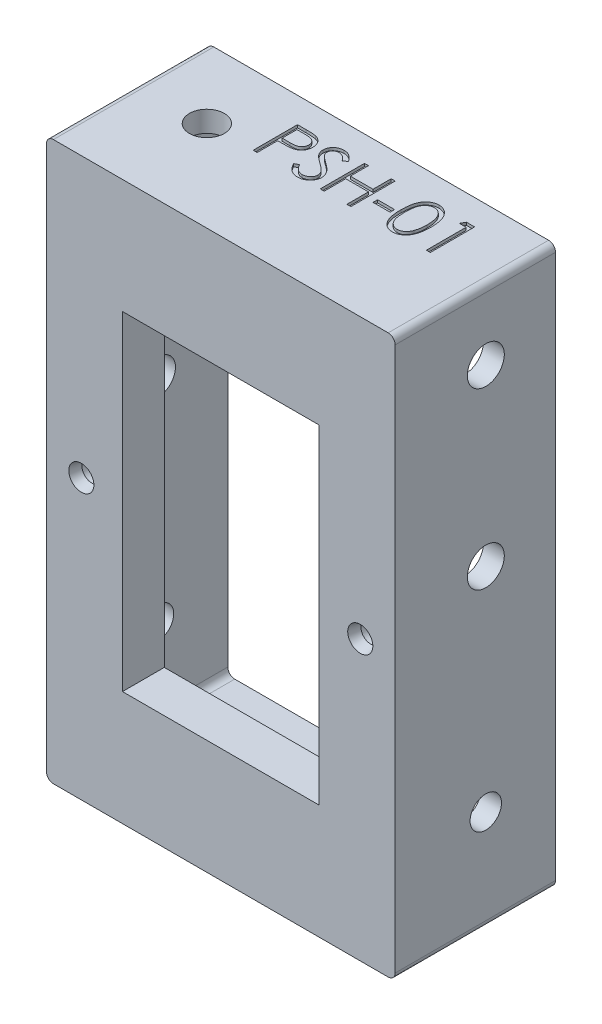
from build123d import *

# Parameters (mm, degrees)
SKETCH3_W                = 50
SKETCH3_H                = 80
SKETCH3_R                = 1.4
SKETCH3_W_2              = 28.2
SKETCH3_H_2              = 47.2
BOSS_EXTRUDE1_DEPTH      = 23
SKETCH4_W                = 44
SKETCH4_H                = 74
CUT_EXTRUDE1_DEPTH       = 17
CHAMFER1_SIZE            = 0.4
CHAMFER1_SIZE2           = 1.492820323
FILLET1_R                = 1
FILLET2_R                = 1
CUT_EXTRUDE2_REACH       = 99.103
SKETCH5_R                = 2.5
SKETCH5_R_2              = 2.25
M5_CLEARANCE_HOLE1_D     = 5.3
M5_CLEARANCE_HOLE1_DEPTH = 3
CUT_EXTRUDE3_REACH       = 99.103
SKETCH8_R                = 2.5
M5_CLEARANCE_HOLE2_D     = 5.3
M5_CLEARANCE_HOLE2_DEPTH = 3
SKETCH12_R               = 2.25
CUT_EXTRUDE4_DEPTH       = 96.592886765
SKETCH13_W               = 2.442307692
SKETCH13_H               = 0.651282051
CUT_EXTRUDE5_DEPTH       = 0.4


with BuildPart() as part:
    # Sketch3 → Boss-Extrude1 (new body)
    with BuildSketch(Plane.XY):
        with Locations((25, 40)):
            Rectangle(SKETCH3_W, SKETCH3_H)
        with Locations((5, 40)):
            Circle(SKETCH3_R, mode=Mode.SUBTRACT)
        with Locations((45, 40)):
            Circle(SKETCH3_R, mode=Mode.SUBTRACT)
        with Locations((25, 40)):
            Rectangle(SKETCH3_W_2, SKETCH3_H_2, mode=Mode.SUBTRACT)
    extrude(amount=BOSS_EXTRUDE1_DEPTH)

    # Sketch4 → Cut-Extrude1 (cut)
    with BuildSketch(Plane(origin=(0, 0, 0), x_dir=(-1, 0, 0), z_dir=(0, 0, -1))):
        with Locations((-25, 40)):
            Rectangle(SKETCH4_W, SKETCH4_H)
    extrude(amount=-CUT_EXTRUDE1_DEPTH, mode=Mode.SUBTRACT)

    # Chamfer1
    chamfer1_edges = [part.edges().sort_by_distance(p)[0] for p in [
        (3.6, 40, 23),
        (43.6, 40, 23),
    ]]
    chamfer1_side = [part.faces().sort_by_distance(p)[0] for p in [
        (25, 0.943398113, 23),
    ]]
    chamfer(chamfer1_edges, length=CHAMFER1_SIZE, length2=CHAMFER1_SIZE2, reference=chamfer1_side[0])

    # Fillet1
    fillet1_edges = [part.edges().sort_by_distance(p)[0] for p in [
        (0, 80, 11.5),
        (50, 80, 11.5),
        (50, 0, 11.5),
        (0, 0, 11.5),
    ]]
    fillet(fillet1_edges, radius=FILLET1_R)

    # Fillet2
    fillet2_edges = [part.edges().sort_by_distance(p)[0] for p in [
        (47, 3, 8.5),
        (47, 77, 8.5),
        (3, 77, 8.5),
        (3, 3, 8.5),
    ]]
    fillet(fillet2_edges, radius=FILLET2_R)

    # Sketch5 → Cut-Extrude2 (cut, up to next)
    with BuildSketch(Plane.ZY, mode=Mode.PRIVATE) as cut_extrude2_sk1:
        with Locations((10, 70)):
            Circle(SKETCH5_R)
    cut_extrude2_tool1 = extrude(cut_extrude2_sk1.sketch, amount=-CUT_EXTRUDE2_REACH, mode=Mode.PRIVATE) & part.part
    # Sketch5 → Cut-Extrude2 (cut, up to next)
    with BuildSketch(Plane.ZY, mode=Mode.PRIVATE) as cut_extrude2_sk2:
        with Locations((10, 45)):
            Circle(SKETCH5_R)
    cut_extrude2_tool2 = extrude(cut_extrude2_sk2.sketch, amount=-CUT_EXTRUDE2_REACH, mode=Mode.PRIVATE) & part.part
    # Sketch5 → Cut-Extrude2 (cut, up to next)
    with BuildSketch(Plane.ZY, mode=Mode.PRIVATE) as cut_extrude2_sk3:
        with Locations((10, 14.5)):
            Circle(SKETCH5_R_2)
    cut_extrude2_tool3 = extrude(cut_extrude2_sk3.sketch, amount=-CUT_EXTRUDE2_REACH, mode=Mode.PRIVATE) & part.part
    add(cut_extrude2_tool1.solids().sort_by_distance((0, 70, 10))[0], mode=Mode.SUBTRACT)
    add(cut_extrude2_tool2.solids().sort_by_distance((0, 45, 10))[0], mode=Mode.SUBTRACT)
    add(cut_extrude2_tool3.solids().sort_by_distance((0, 14.5, 10))[0], mode=Mode.SUBTRACT)

    # M5 Clearance Hole1
    with Locations(Plane.ZY.offset(-47)):
        with Locations((10, 70), (10, 45)):
            Hole(M5_CLEARANCE_HOLE1_D / 2, depth=M5_CLEARANCE_HOLE1_DEPTH)

    # Sketch8 → Cut-Extrude3 (cut, up to next)
    with BuildSketch(Plane(origin=(0, 80, 0), x_dir=(1, 0, 0), z_dir=(0, 1, 0)), mode=Mode.PRIVATE) as cut_extrude3_sk1:
        with Locations(Location((10, -10, 0), (0, 0, 270))):
            Circle(SKETCH8_R)
    cut_extrude3_tool1 = extrude(cut_extrude3_sk1.sketch, amount=-CUT_EXTRUDE3_REACH, mode=Mode.PRIVATE) & part.part
    add(cut_extrude3_tool1.solids().sort_by_distance((10, 80, 10))[0], mode=Mode.SUBTRACT)

    # M5 Clearance Hole2
    with Locations(Plane(origin=(0, 3, 0), x_dir=(1, 0, 0), z_dir=(0, 1, 0))):
        with Locations((10, -10)):
            Hole(M5_CLEARANCE_HOLE2_D / 2, depth=M5_CLEARANCE_HOLE2_DEPTH)

    # Sketch12 → Cut-Extrude4 (cut, through all)
    with BuildSketch(Plane.ZY.offset(-47)):
        with Locations((10, 14.5)):
            Circle(SKETCH12_R)
    extrude(amount=-CUT_EXTRUDE4_DEPTH, mode=Mode.SUBTRACT)

    # Sketch13 → Cut-Extrude5 (cut)
    # profile 1 of 6: a face of its own
    with BuildSketch(Plane(origin=(0, 80, 0), x_dir=(1, 0, 0), z_dir=(0, 1, 0))):
        with BuildLine():
            Line((16.648717949, -3.65), (17.894040465, -3.65))
            add(Edge.make_bspline(
                [(17.894040465, -3.65), (17.979694537, -3.650094155), (18.143811544, -3.650274559), (18.379151717, -3.655744169), (18.59289223, -3.663049739), (18.784572207, -3.673176888), (18.954781413, -3.685144988), (19.102749657, -3.701930831), (19.229639995, -3.719457367), (19.305670267, -3.737276204), (19.340344551, -3.745402644)],
                knots=[0, 0, 0, 0, 1.415646017, 2.712440637, 3.8905458, 4.950247383, 5.884950622, 6.709939814, 7.411656543, 8, 8, 8, 8], degree=3))
            add(Edge.make_bspline(
                [(19.340344551, -3.745402644), (19.384238534, -3.757416753), (19.470992193, -3.781161874), (19.595998371, -3.828721058), (19.714931776, -3.885112986), (19.828200461, -3.949382134), (19.934412526, -4.024285943), (20.035152629, -4.106788078), (20.129531736, -4.198793353), (20.217019118, -4.299269838), (20.297364394, -4.40653079), (20.366542533, -4.522177407), (20.424467644, -4.644263058), (20.474148723, -4.772702823), (20.50990549, -4.908575267), (20.536842008, -5.050936302), (20.553939161, -5.199770668), (20.555576666, -5.301479285), (20.556410256, -5.353255208)],
                knots=[0, 0, 0, 0, 0.999701418, 1.975846123, 2.934577507, 3.890451536, 4.834027766, 5.787354733, 6.749476667, 7.726910423, 8.712836071, 9.690891519, 10.682875813, 11.679750201, 12.712814741, 13.765529915, 14.8625177, 16, 16, 16, 16], degree=3))
            add(Edge.make_bspline(
                [(20.556410256, -5.353255208), (20.555645672, -5.405466318), (20.55414971, -5.507620879), (20.536195021, -5.657068652), (20.512010244, -5.799886303), (20.474822735, -5.935757163), (20.426117014, -6.063874347), (20.368981432, -6.186195725), (20.300068456, -6.300640272), (20.220884265, -6.407623471), (20.132797801, -6.507245741), (20.036181756, -6.598785154), (19.931426182, -6.681705882), (19.818863999, -6.75619382), (19.697397845, -6.820521641), (19.568869938, -6.878138466), (19.432163116, -6.92652739), (19.337561698, -6.95198193), (19.289463141, -6.964923878)],
                knots=[0, 0, 0, 0, 1.121902311, 2.195077645, 3.232258892, 4.234102512, 5.217864754, 6.176164875, 7.132989551, 8.084763148, 9.034132444, 9.988522005, 10.94243251, 11.903244335, 12.886203696, 13.894208494, 14.929344452, 16, 16, 16, 16], degree=3))
            add(Edge.make_bspline(
                [(19.289463141, -6.964923878), (19.249680692, -6.973383858), (19.162495143, -6.991924396), (19.018907632, -7.012622596), (18.851729575, -7.030289386), (18.661189153, -7.043535736), (18.447457397, -7.05487569), (18.210418687, -7.063889232), (17.949607718, -7.068841967), (17.767687033, -7.069097405), (17.67270633, -7.069230769)],
                knots=[0, 0, 0, 0, 0.601384939, 1.31797006, 2.144135048, 3.087295005, 4.142315834, 5.309527816, 6.595305764, 8, 8, 8, 8], degree=3))
            Line((17.67270633, -7.069230769), (17.218589744, -7.069230769))
            Line((17.218589744, -7.069230769), (17.218589744, -10))
            Line((17.218589744, -10), (16.648717949, -10))
            Line((16.648717949, -10), (16.648717949, -3.65))
        make_face()
        with BuildLine():
            Line((17.218589744, -4.301282051), (17.218589744, -6.417948718))
            Line((17.218589744, -6.417948718), (18.330348558, -6.431941106))
            add(Edge.make_bspline(
                [(18.330348558, -6.431941106), (18.384631852, -6.431969161), (18.489424632, -6.432023321), (18.640801779, -6.424792987), (18.781244344, -6.416446307), (18.91032093, -6.404225417), (19.028089726, -6.386951136), (19.1347471, -6.369512697), (19.229466027, -6.344284396), (19.340317436, -6.310315399), (19.463840081, -6.252380511), (19.598219776, -6.168288567), (19.712103554, -6.061099283), (19.810652464, -5.940580217), (19.888858842, -5.806506082), (19.946110428, -5.66305244), (19.979749385, -5.511690484), (19.984260051, -5.40811629), (19.986538462, -5.355799279)],
                knots=[0, 0, 0, 0, 1.160613943, 2.240541288, 3.23993089, 4.169200891, 5.011653406, 5.7853311, 6.478053781, 7.106038997, 8.262395093, 9.384106736, 10.481365981, 11.59014053, 12.70357646, 13.786202915, 14.881775077, 16, 16, 16, 16], degree=3))
            add(Edge.make_bspline(
                [(19.986538462, -5.355799279), (19.98424766, -5.304747976), (19.97969383, -5.203264304), (19.945846764, -5.05453141), (19.888970152, -4.912589489), (19.810127473, -4.780195463), (19.714439995, -4.660110061), (19.603225472, -4.555793845), (19.476745698, -4.47193447), (19.359092479, -4.417808373), (19.25458747, -4.384760659), (19.1638152, -4.361637877), (19.061324976, -4.34317642), (18.947083433, -4.328227608), (18.821976035, -4.315430614), (18.684927949, -4.306747484), (18.536458339, -4.301664842), (18.433387732, -4.301412737), (18.379957933, -4.301282051)],
                knots=[0, 0, 0, 0, 1.120700087, 2.227813068, 3.331159281, 4.466773991, 5.599788987, 6.693661531, 7.80175334, 8.91857717, 9.525282508, 10.207424825, 10.974604443, 11.810962634, 12.737642355, 13.736264703, 14.826523623, 16, 16, 16, 16], degree=3))
            Line((18.379957933, -4.301282051), (17.218589744, -4.301282051))
        make_face(mode=Mode.SUBTRACT)
    # profile 2 of 6: a face of its own
    with BuildSketch(Plane(origin=(0, 80, 0), x_dir=(1, 0, 0), z_dir=(0, 1, 0))):
        with BuildLine():
            Line((21.207692308, -8.775030048), (21.744491186, -8.453205128))
            add(Edge.make_bspline(
                [(21.744491186, -8.453205128), (21.794417131, -8.536779084), (21.890073314, -8.696903557), (22.049642209, -8.913271716), (22.214983347, -9.097171629), (22.387321138, -9.247533475), (22.565603644, -9.365913598), (22.750994713, -9.449737647), (22.942869598, -9.502018059), (23.073450674, -9.508368216), (23.138641827, -9.511538462)],
                knots=[0, 0, 0, 0, 1.272034388, 2.437168799, 3.508375237, 4.49857839, 5.41946034, 6.295179144, 7.148887113, 8, 8, 8, 8], degree=3))
            add(Edge.make_bspline(
                [(23.138641827, -9.511538462), (23.19431656, -9.509987841), (23.304691848, -9.506913733), (23.467183346, -9.477375707), (23.624993187, -9.431996559), (23.774868858, -9.367007154), (23.91474233, -9.288378759), (24.037400192, -9.193407837), (24.14343814, -9.087079435), (24.230177534, -8.968456619), (24.296725598, -8.84088122), (24.347874065, -8.709933423), (24.376258698, -8.573556163), (24.380534522, -8.481734324), (24.382692308, -8.435396635)],
                knots=[0, 0, 0, 0, 1.095163259, 2.171163733, 3.241058638, 4.321873601, 5.38011039, 6.391990106, 7.366004449, 8.327778327, 9.272591725, 10.192022065, 11.087607919, 12, 12, 12, 12], degree=3))
            add(Edge.make_bspline(
                [(24.382692308, -8.435396635), (24.380017487, -8.382526807), (24.374579967, -8.275050174), (24.328621425, -8.116482232), (24.256323505, -7.959559998), (24.189625566, -7.862493416), (24.154997997, -7.812099359)],
                knots=[0, 0, 0, 0, 0.938893495, 1.908633276, 2.914225137, 4, 4, 4, 4], degree=3))
            add(Edge.make_bspline(
                [(24.154997997, -7.812099359), (24.126567025, -7.775728693), (24.066879757, -7.69937303), (23.96426827, -7.585716674), (23.843861177, -7.4684804), (23.709779013, -7.34318754), (23.557137552, -7.215665394), (23.390717633, -7.079832947), (23.206270346, -6.9408558), (23.076912688, -6.847651288), (23.010166266, -6.799559295)],
                knots=[0, 0, 0, 0, 0.722233717, 1.516239348, 2.393582979, 3.351407094, 4.387010283, 5.505090956, 6.712668013, 8, 8, 8, 8], degree=3))
            add(Edge.make_bspline(
                [(23.010166266, -6.799559295), (22.943357016, -6.751973143), (22.815622817, -6.660992044), (22.636990817, -6.525965129), (22.477253006, -6.402514109), (22.337119362, -6.28947683), (22.216651522, -6.186837961), (22.11490019, -6.095583129), (22.03445738, -6.013244382), (21.989725112, -5.959829377), (21.969641426, -5.935847356)],
                knots=[0, 0, 0, 0, 1.452282411, 2.77665338, 3.964542531, 5.026858415, 5.96415736, 6.766646006, 7.446254459, 8, 8, 8, 8], degree=3))
            add(Edge.make_bspline(
                [(21.969641426, -5.935847356), (21.941569809, -5.898471189), (21.886363205, -5.824965941), (21.813490595, -5.710076556), (21.751552399, -5.592468631), (21.702997883, -5.471826134), (21.662110743, -5.349842763), (21.634609926, -5.224926932), (21.61738982, -5.097639153), (21.615626358, -5.011980373), (21.61474359, -4.969100561)],
                knots=[0, 0, 0, 0, 1.068054152, 2.10047183, 3.106115577, 4.101338837, 5.06977816, 6.043150881, 7.020423561, 8, 8, 8, 8], degree=3))
            add(Edge.make_bspline(
                [(21.61474359, -4.969100561), (21.617111612, -4.90191797), (21.621797041, -4.768988769), (21.66142198, -4.574804262), (21.723965658, -4.389408905), (21.811586383, -4.214638157), (21.924539009, -4.055042734), (22.055250991, -3.908786836), (22.210937545, -3.785835266), (22.381757304, -3.678407674), (22.568731008, -3.594322924), (22.764657361, -3.530893717), (22.969847763, -3.494954064), (23.108827736, -3.489796476), (23.179346955, -3.487179487)],
                knots=[0, 0, 0, 0, 1.005424448, 1.989358655, 2.955360095, 3.929531133, 4.905563448, 5.876582895, 6.856512386, 7.866279853, 8.892233794, 9.918561126, 10.94386622, 12, 12, 12, 12], degree=3))
            add(Edge.make_bspline(
                [(23.179346955, -3.487179487), (23.254175537, -3.489760402), (23.402985704, -3.494893019), (23.621877852, -3.539519968), (23.83262658, -3.613362616), (24.002159361, -3.697162038), (24.134843085, -3.780857606), (24.236030757, -3.857093573), (24.338569561, -3.944859842), (24.443286603, -4.044390188), (24.548407514, -4.156597865), (24.65549292, -4.280714401), (24.764793236, -4.415981295), (24.83510744, -4.512545746), (24.871153846, -4.562049279)],
                knots=[0, 0, 0, 0, 1.286793592, 2.559021753, 3.825965368, 5.121522368, 5.803751409, 6.523245864, 7.299691795, 8.125521123, 9.008227632, 9.944561021, 10.946284179, 12, 12, 12, 12], degree=3))
            Line((24.871153846, -4.562049279), (24.355979567, -4.952564103))
            add(Edge.make_bspline(
                [(24.355979567, -4.952564103), (24.324871947, -4.912488907), (24.264965943, -4.835313451), (24.174016732, -4.727234064), (24.088294185, -4.628507022), (24.003838459, -4.542754576), (23.925110014, -4.465280705), (23.848697666, -4.398950861), (23.775701057, -4.343115137), (23.68368609, -4.283527536), (23.568083944, -4.224460737), (23.422969143, -4.174478838), (23.271319758, -4.144443225), (23.168033141, -4.140471958), (23.115745192, -4.138461538)],
                knots=[0, 0, 0, 0, 1.181633172, 2.275549214, 3.290209073, 4.226197932, 5.078386478, 5.862611352, 6.581680152, 7.217281963, 8.414376989, 9.595101626, 10.782541182, 12, 12, 12, 12], degree=3))
            add(Edge.make_bspline(
                [(23.115745192, -4.138461538), (23.05014693, -4.140659908), (22.923646861, -4.144899258), (22.74405029, -4.191199802), (22.582408455, -4.264101178), (22.443520229, -4.366272638), (22.327883143, -4.487323582), (22.244234667, -4.626622362), (22.19388794, -4.780441863), (22.187744261, -4.887741726), (22.184615385, -4.942387821)],
                knots=[0, 0, 0, 0, 1.14458467, 2.207223713, 3.21896685, 4.227309161, 5.202851033, 6.127160689, 7.046193047, 8, 8, 8, 8], degree=3))
            add(Edge.make_bspline(
                [(22.184615385, -4.942387821), (22.185328629, -4.97640836), (22.186756283, -5.04450507), (22.206667702, -5.145109792), (22.232247913, -5.245460365), (22.27278383, -5.345105623), (22.328746024, -5.445788246), (22.402233986, -5.549241969), (22.494786709, -5.656378641), (22.565683575, -5.72606059), (22.603114984, -5.762850561)],
                knots=[0, 0, 0, 0, 0.858281714, 1.717966888, 2.583508476, 3.4729293, 4.427298488, 5.488583878, 6.674047936, 8, 8, 8, 8], degree=3))
            add(Edge.make_bspline(
                [(22.603114984, -5.762850561), (22.617014902, -5.775254879), (22.650037927, -5.8047247), (22.710409964, -5.852970695), (22.790134755, -5.912484296), (22.887130463, -5.986121284), (23.003185533, -6.071540509), (23.138312728, -6.167649776), (23.291005795, -6.277569109), (23.399358414, -6.35441779), (23.456650641, -6.395052083)],
                knots=[0, 0, 0, 0, 0.420754252, 0.999615792, 1.744751191, 2.668019286, 3.750313428, 4.999500688, 6.413464383, 8, 8, 8, 8], degree=3))
            add(Edge.make_bspline(
                [(23.456650641, -6.395052083), (23.525567941, -6.445201407), (23.65901674, -6.542308622), (23.848895492, -6.688205641), (24.021059973, -6.830895164), (24.176114642, -6.969465966), (24.315591319, -7.102866935), (24.437942612, -7.23270299), (24.544415204, -7.358043958), (24.659040357, -7.518739917), (24.776166687, -7.716099884), (24.876753422, -7.957904688), (24.940177852, -8.200649441), (24.948471887, -8.363802416), (24.952564103, -8.444300881)],
                knots=[0, 0, 0, 0, 1.163667725, 2.253281268, 3.268753668, 4.215851969, 5.092017293, 5.902905408, 6.650798638, 7.335211899, 8.59617414, 9.77448103, 10.901945474, 12, 12, 12, 12], degree=3))
            add(Edge.make_bspline(
                [(24.952564103, -8.444300881), (24.951371866, -8.501230201), (24.949010546, -8.613983311), (24.921867174, -8.779546093), (24.882098639, -8.940347814), (24.822159657, -9.094400832), (24.749001927, -9.244523473), (24.656171734, -9.386777807), (24.548570649, -9.524312273), (24.425137961, -9.653459464), (24.290071824, -9.772016134), (24.147317121, -9.87747886), (23.996640198, -9.965414247), (23.838858452, -10.037170774), (23.673935641, -10.093293013), (23.501927233, -10.133956362), (23.322549691, -10.158913152), (23.200628817, -10.161503519), (23.138641827, -10.162820513)],
                knots=[0, 0, 0, 0, 0.983748083, 1.948392443, 2.894712957, 3.844097841, 4.80183111, 5.778335162, 6.776009319, 7.81870978, 8.863265674, 9.881300176, 10.883814829, 11.87499822, 12.874611388, 13.892143829, 14.928324115, 16, 16, 16, 16], degree=3))
            add(Edge.make_bspline(
                [(23.138641827, -10.162820513), (23.090680562, -10.161893083), (22.995362054, -10.160049904), (22.854374851, -10.143755296), (22.716235882, -10.120700979), (22.582678542, -10.084099452), (22.451982095, -10.039691222), (22.32471497, -9.985011676), (22.200815486, -9.919484754), (22.0795893, -9.84456378), (21.961344727, -9.757373301), (21.847190835, -9.655821386), (21.73338217, -9.542708827), (21.623277893, -9.414963948), (21.514650903, -9.274650569), (21.409642931, -9.120455907), (21.306080386, -8.953219851), (21.241100895, -8.835536053), (21.207692308, -8.775030048)],
                knots=[0, 0, 0, 0, 0.915332311, 1.819136955, 2.706846663, 3.586547465, 4.459518054, 5.340707479, 6.227863349, 7.133153174, 8.059268498, 9.028702269, 10.047606654, 11.120612155, 12.245963614, 13.433783089, 14.680604001, 16, 16, 16, 16], degree=3))
        make_face()
    # profile 3 of 6: a face of its own
    with BuildSketch(Plane(origin=(0, 80, 0), x_dir=(1, 0, 0), z_dir=(0, 1, 0))):
        Polygon((26.255128205, -3.65), (26.825, -3.65), (26.825, -6.255128205), (30.081410256, -6.255128205), (30.081410256, -3.65), (30.651282051, -3.65), (30.651282051, -10), (30.081410256, -10), (30.081410256, -6.906410256), (26.825, -6.906410256), (26.825, -10), (26.255128205, -10), align=None)
    # profile 4 of 6: a face of its own
    with BuildSketch(Plane(origin=(0, 80, 0), x_dir=(1, 0, 0), z_dir=(0, 1, 0))):
        with Locations((32.930769231, -7.557692307)):
            Rectangle(SKETCH13_W, SKETCH13_H)
    # profile 5 of 6: a face of its own
    with BuildSketch(Plane(origin=(0, 80, 0), x_dir=(1, 0, 0), z_dir=(0, 1, 0))):
        with BuildLine():
            add(Edge.make_bspline(
                [(34.640384615, -6.827544071), (34.640979734, -6.725767381), (34.642135761, -6.528064696), (34.654996181, -6.239983988), (34.676360017, -5.969727464), (34.705637822, -5.717282187), (34.741266729, -5.482582985), (34.788829112, -5.266257069), (34.842918054, -5.067303211), (34.905606062, -4.885072637), (34.976341051, -4.717110233), (35.053328924, -4.560310225), (35.139625051, -4.414909862), (35.23029745, -4.278588443), (35.329016494, -4.153577453), (35.432972871, -4.03811148), (35.54622399, -3.934859118), (35.664920019, -3.840795113), (35.790135605, -3.758336785), (35.918301585, -3.68570596), (36.050300134, -3.623657629), (36.186491637, -3.574870695), (36.325651992, -3.534573873), (36.46826767, -3.507016783), (36.614574145, -3.48967782), (36.713328319, -3.488020166), (36.763411458, -3.487179487)],
                knots=[0, 0, 0, 0, 1.646270934, 3.197905019, 4.663502075, 6.030701355, 7.308322542, 8.50163776, 9.611534131, 10.641858119, 11.616356847, 12.558055219, 13.465016945, 14.349605745, 15.204443733, 16.039544428, 16.859896111, 17.680448484, 18.487036065, 19.28249412, 20.06191084, 20.843045899, 21.620316918, 22.403196591, 23.190181807, 24, 24, 24, 24], degree=3))
            add(Edge.make_bspline(
                [(36.763411458, -3.487179487), (36.813912969, -3.488064523), (36.914344585, -3.489824582), (37.062826409, -3.506740877), (37.207877974, -3.534809915), (37.348880883, -3.574580826), (37.486993359, -3.623921554), (37.621135127, -3.685765323), (37.752139404, -3.757754125), (37.877924354, -3.84234316), (37.99987087, -3.936653861), (38.114983603, -4.043266132), (38.22327303, -4.161103479), (38.326098227, -4.288905147), (38.420541954, -4.429122372), (38.510482323, -4.5793164), (38.590985874, -4.742113826), (38.668518785, -4.914798389), (38.735442318, -5.10214817), (38.795796792, -5.303107093), (38.84456292, -5.520048832), (38.885183457, -5.751835163), (38.916652054, -5.999317311), (38.939571276, -6.261964769), (38.951678159, -6.539950335), (38.953958174, -6.730011004), (38.955128205, -6.827544071)],
                knots=[0, 0, 0, 0, 0.810914788, 1.612654377, 2.396697861, 3.181598691, 3.963628158, 4.749916497, 5.551656086, 6.361998678, 7.18212741, 8.025565596, 8.878627764, 9.750805457, 10.657531673, 11.591944965, 12.560506719, 13.57287815, 14.630710178, 15.753379473, 16.941251878, 18.199788006, 19.531962791, 20.947069417, 22.433333509, 24, 24, 24, 24], degree=3))
            add(Edge.make_bspline(
                [(38.955128205, -6.827544071), (38.953946045, -6.924651732), (38.951642653, -7.11386205), (38.939706999, -7.39059682), (38.91619634, -7.651850413), (38.88678679, -7.898249395), (38.846054328, -8.128768217), (38.79597067, -8.344204574), (38.740362227, -8.545488818), (38.6717191, -8.730971976), (38.59658824, -8.903241531), (38.514845241, -9.064109071), (38.427269985, -9.214996488), (38.331858977, -9.354696029), (38.23016207, -9.484197307), (38.120002653, -9.601214422), (38.00448602, -9.708566927), (37.882180637, -9.804092022), (37.754433965, -9.887703025), (37.62387964, -9.962476725), (37.488201216, -10.022770329), (37.35047343, -10.074541046), (37.208726252, -10.114093295), (37.063136372, -10.141441575), (36.914444344, -10.160621929), (36.813930076, -10.162085114), (36.763411458, -10.162820513)],
                knots=[0, 0, 0, 0, 1.561518951, 3.042555995, 4.452378317, 5.7783523, 7.031515105, 8.214008947, 9.334062868, 10.386615937, 11.391082383, 12.354592575, 13.286541444, 14.194233754, 15.072674879, 15.931287219, 16.775624067, 17.606195743, 18.42308326, 19.229000347, 20.022332153, 20.807536673, 21.593273796, 22.3848459, 23.188221202, 24, 24, 24, 24], degree=3))
            add(Edge.make_bspline(
                [(36.763411458, -10.162820513), (36.713329709, -10.161974411), (36.614578274, -10.160306063), (36.46825173, -10.143045436), (36.326225012, -10.115295023), (36.187797272, -10.076439184), (36.052258309, -10.028877981), (35.921455046, -9.96691344), (35.793933106, -9.895550201), (35.670032711, -9.814278508), (35.552082076, -9.721166311), (35.439417464, -9.618179673), (35.334869215, -9.502748627), (35.237561641, -9.376695824), (35.145080081, -9.241180941), (35.060009361, -9.09435375), (34.98132224, -8.936796443), (34.909397621, -8.76749109), (34.845627903, -8.58396715), (34.78929849, -8.384125069), (34.744822804, -8.166200986), (34.706753728, -7.931945191), (34.676048062, -7.680351061), (34.655085214, -7.411282006), (34.642128829, -7.124905698), (34.640976629, -6.928473393), (34.640384615, -6.827544071)],
                knots=[0, 0, 0, 0, 0.810891512, 1.598919785, 2.382837074, 3.152667961, 3.926044502, 4.706494248, 5.493654104, 6.291793342, 7.103789334, 7.925228297, 8.761435821, 9.622817696, 10.50288917, 11.416980706, 12.369136599, 13.353924996, 14.394355917, 15.514179734, 16.714354668, 17.994756427, 19.357759367, 20.818452758, 22.365282078, 24, 24, 24, 24], degree=3))
        make_face()
        with BuildLine():
            add(Edge.make_bspline(
                [(35.21025641, -6.825), (35.210473121, -6.909815496), (35.210893715, -7.074425721), (35.221881393, -7.313627065), (35.236849671, -7.536730376), (35.256156025, -7.744018935), (35.284827089, -7.934791101), (35.316952261, -8.110358954), (35.356046652, -8.26979337), (35.402301899, -8.414188398), (35.454987117, -8.545994565), (35.512510613, -8.668642484), (35.574306496, -8.783580998), (35.643465526, -8.889777687), (35.718785712, -8.98757887), (35.798565768, -9.078715581), (35.885783171, -9.159990104), (36.006439961, -9.257465969), (36.16572785, -9.358193541), (36.366424962, -9.445907161), (36.572652009, -9.501029617), (36.71262642, -9.508039575), (36.782491987, -9.511538462)],
                knots=[0, 0, 0, 0, 1.459021318, 2.831673884, 4.118529203, 5.306027144, 6.411944654, 7.436330062, 8.375795394, 9.233974572, 10.042671642, 10.816086306, 11.563610507, 12.285937304, 12.993564865, 13.685989202, 14.367179055, 15.041617293, 16.353048772, 17.594441528, 18.799311195, 20, 20, 20, 20], degree=3))
            add(Edge.make_bspline(
                [(36.782491987, -9.511538462), (36.852809477, -9.508639631), (36.993299278, -9.502847954), (37.198556306, -9.446970245), (37.397819796, -9.362661223), (37.553978888, -9.262970749), (37.672782931, -9.168032208), (37.757903756, -9.087088489), (37.836030615, -8.996454273), (37.910129808, -8.89866555), (37.978091274, -8.791854043), (38.039891538, -8.676533371), (38.096285612, -8.552383291), (38.128414881, -8.465715336), (38.144841747, -8.421404247)],
                knots=[0, 0, 0, 0, 1.353760809, 2.704726607, 4.075137775, 5.516104923, 6.260822281, 7.007110065, 7.778089737, 8.566572457, 9.372053459, 10.217411131, 11.088608312, 12, 12, 12, 12], degree=3))
            add(Edge.make_bspline(
                [(38.144841747, -8.421404247), (38.163985668, -8.364744577), (38.202856039, -8.249701147), (38.252951687, -8.071241378), (38.292404054, -7.884002078), (38.327897589, -7.689102224), (38.352123847, -7.48510448), (38.371623452, -7.272640041), (38.383109126, -7.051548712), (38.384532889, -6.901334943), (38.38525641, -6.825)],
                knots=[0, 0, 0, 0, 0.884706709, 1.796334032, 2.740027952, 3.714592787, 4.726048262, 5.777819803, 6.87074269, 8, 8, 8, 8], degree=3))
            add(Edge.make_bspline(
                [(38.38525641, -6.825), (38.38425821, -6.748677404), (38.382305516, -6.599374091), (38.374841567, -6.380719677), (38.355567368, -6.173042454), (38.334160395, -5.975447739), (38.302596865, -5.789029333), (38.268564844, -5.612226636), (38.222842645, -5.447230006), (38.174002482, -5.291456193), (38.118103621, -5.146675006), (38.056570789, -5.012211422), (37.990854169, -4.887416278), (37.919476105, -4.77263197), (37.843283937, -4.667344356), (37.760266669, -4.573664449), (37.673717307, -4.488688807), (37.552491841, -4.391692432), (37.393788487, -4.292792641), (37.196311384, -4.20177762), (36.990806072, -4.149511146), (36.851879948, -4.142142085), (36.782491987, -4.138461538)],
                knots=[0, 0, 0, 0, 1.31362396, 2.569729283, 3.763502607, 4.902122613, 5.988968491, 7.01645872, 7.998833611, 8.933434873, 9.825090667, 10.667526885, 11.477055099, 12.250526234, 12.991942729, 13.710640831, 14.402115721, 15.076753259, 16.378508321, 17.609869233, 18.806226677, 20, 20, 20, 20], degree=3))
            add(Edge.make_bspline(
                [(36.782491987, -4.138461538), (36.712259913, -4.142147163), (36.571667819, -4.149525127), (36.364026529, -4.201582887), (36.164991491, -4.292320696), (36.006707809, -4.392020001), (35.885397796, -4.486976651), (35.799976338, -4.569320647), (35.719882568, -4.659393137), (35.646099741, -4.758093754), (35.576994899, -4.864166634), (35.513529347, -4.97844625), (35.456347906, -5.101511726), (35.403580248, -5.233258687), (35.357183904, -5.377641258), (35.318913428, -5.536879289), (35.283558346, -5.711888721), (35.258529786, -5.903694114), (35.236279829, -6.111034592), (35.221980812, -6.33469487), (35.21085696, -6.574297388), (35.210460603, -6.739758719), (35.21025641, -6.825)],
                knots=[0, 0, 0, 0, 1.207732386, 2.417664972, 3.655092373, 4.956220595, 5.625982001, 6.301752483, 6.994047911, 7.697131622, 8.419323945, 9.170223765, 9.943494443, 10.752040957, 11.610060368, 12.549350801, 13.567764191, 14.679664412, 15.874934091, 17.154273443, 18.533957287, 20, 20, 20, 20], degree=3))
        make_face(mode=Mode.SUBTRACT)
    # profile 6 of 6: a face of its own
    with BuildSketch(Plane(origin=(0, 80, 0), x_dir=(1, 0, 0), z_dir=(0, 1, 0))):
        Polygon((40.874629407, -3.65), (42.048717949, -3.65), (42.048717949, -10), (41.478846154, -10), (41.478846154, -4.301282051), (40.501923077, -4.301282051), align=None)
    extrude(amount=-CUT_EXTRUDE5_DEPTH, mode=Mode.SUBTRACT)


solid = part.part
